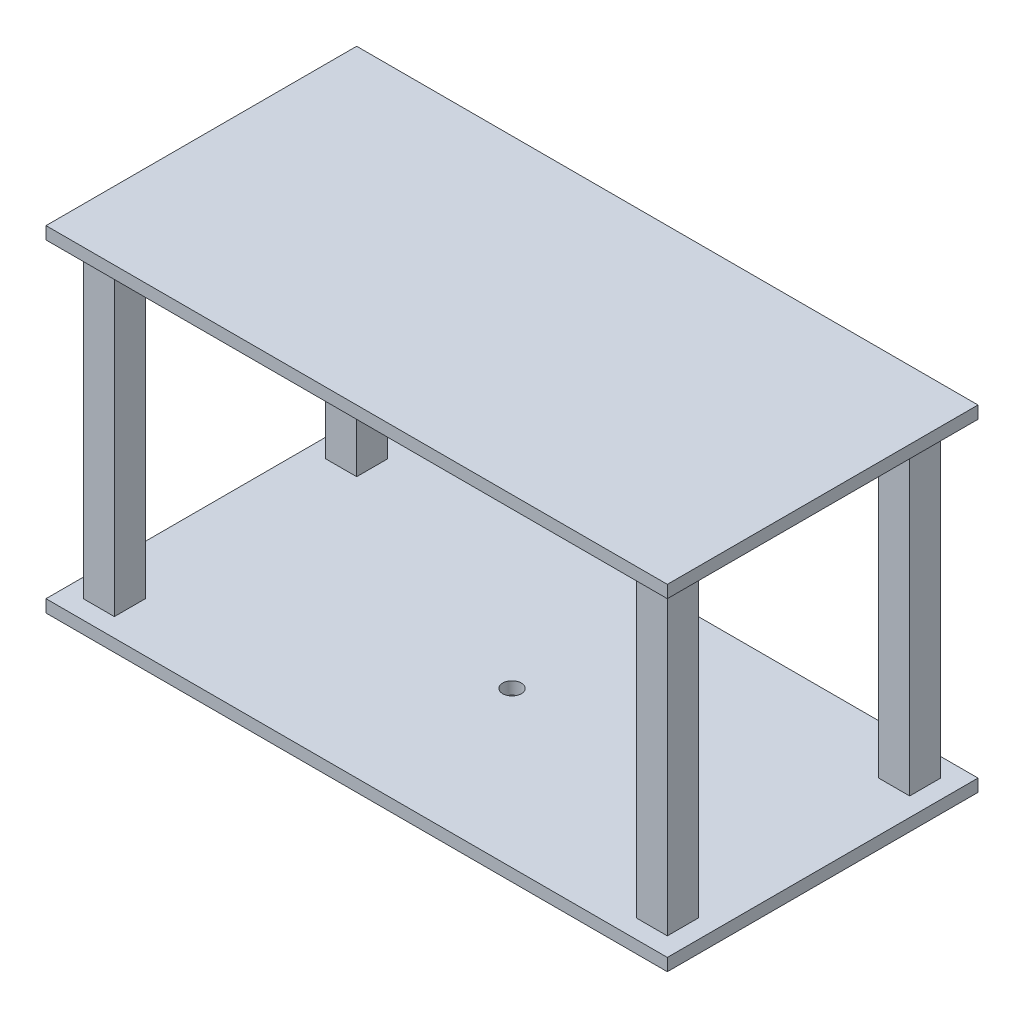
from build123d import *

# Parameters (mm, degrees)
SKETCH2_W                                  = 100
SKETCH2_H                                  = 50
BOSS_EXTRUDE1_DEPTH                        = 2
CUT_EXTRUDE1_REACH                         = 57.937
SKETCH3_R                                  = 1.5
SKETCH4_W                                  = 5
SKETCH4_H                                  = 5
BOSS_EXTRUDE2_DEPTH                        = 50
MIRROR1_AT_THE_SECOND_PLANE_COPY_1_SKETC_W = 5
MIRROR1_AT_THE_SECOND_PLANE_COPY_1_SKETC_H = 5
MIRROR1_AT_THE_SECOND_PLANE_COPY_1_DEPTH   = 50
SKETCH5_W                                  = 100
SKETCH5_H                                  = 50
BOSS_EXTRUDE3_DEPTH                        = 2


with BuildPart() as part:
    # Sketch2 → Boss-Extrude1 (new body)
    with BuildSketch(Plane(origin=(0, 0, 0), x_dir=(1, 0, 0), z_dir=(0, 1, 0))):
        Rectangle(SKETCH2_W, SKETCH2_H)
    extrude(amount=BOSS_EXTRUDE1_DEPTH)

    # Sketch3 → Cut-Extrude1 (cut, up to next)
    with BuildSketch(Plane(origin=(0, 2, 0), x_dir=(1, 0, 0), z_dir=(0, 1, 0)), mode=Mode.PRIVATE) as cut_extrude1_sk1:
        with Locations(Location((0, 0, 0), (0, 0, 270))):
            Circle(SKETCH3_R)
    cut_extrude1_tool1 = extrude(cut_extrude1_sk1.sketch, amount=-CUT_EXTRUDE1_REACH, mode=Mode.PRIVATE) & part.part
    add(cut_extrude1_tool1.solids().sort_by_distance((0, 2, 0))[0], mode=Mode.SUBTRACT)

    # Sketch4 → Boss-Extrude2 (add)
    with BuildSketch(Plane(origin=(0, 2, 0), x_dir=(1, 0, 0), z_dir=(0, 1, 0))):
        with Locations((-44.5, 19.5)):
            Rectangle(SKETCH4_W, SKETCH4_H)
    boss_extrude2 = extrude(amount=BOSS_EXTRUDE2_DEPTH)

    # Mirror1: Boss-Extrude2 across plane
    add(boss_extrude2.mirror(Plane.XY))

    # Mirror1 at the second plane: Boss-Extrude2 across plane
    add(boss_extrude2.mirror(Plane(origin=(0, 0, 0), x_dir=(0, 0, 1), z_dir=(1, 0, 0))))

    # Mirror1 at the second plane copy 1 sketc → Mirror1 at the second plane copy 1 (add)
    with BuildSketch(Plane(origin=(0, 2, 0), x_dir=(-1, 0, 0), z_dir=(0, 1, 0))):
        with Locations((-44.5, 19.5)):
            Rectangle(MIRROR1_AT_THE_SECOND_PLANE_COPY_1_SKETC_W, MIRROR1_AT_THE_SECOND_PLANE_COPY_1_SKETC_H)
    extrude(amount=MIRROR1_AT_THE_SECOND_PLANE_COPY_1_DEPTH)

    # Sketch5 → Boss-Extrude3 (add)
    with BuildSketch(Plane(origin=(0, 52, 0), x_dir=(1, 0, 0), z_dir=(0, 1, 0))):
        Rectangle(SKETCH5_W, SKETCH5_H)
    extrude(amount=BOSS_EXTRUDE3_DEPTH)


solid = part.part
